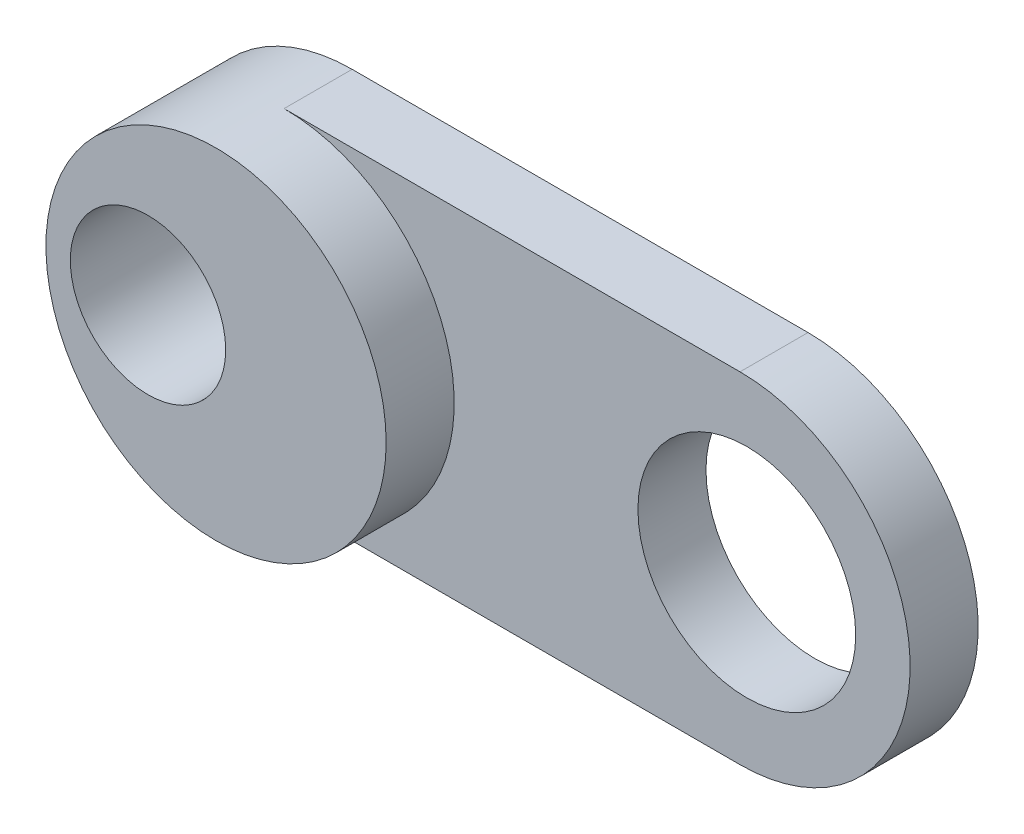
from build123d import *

# Parameters (mm, degrees)
SKETCH1_R           = 2.9
SKETCH1_R_2         = 4.064
BOSS_EXTRUDE1_DEPTH = 2.54
SKETCH2_R           = 2.9
BOSS_EXTRUDE2_DEPTH = 2.54


with BuildPart() as part:
    # Sketch1 → Boss-Extrude1 (new body)
    with BuildSketch(Plane.XY):
        with BuildLine():
            Line((0, 12.7), (17.018, 12.7))
            ThreePointArc((17.018, 12.7), (23.368, 6.35), (17.018, 0))
            Line((17.018, 0), (0, 0))
            ThreePointArc((0, 0), (-6.35, 6.35), (0, 12.7))
        make_face()
        with Locations((-2.54, 6.35)):
            Circle(SKETCH1_R, mode=Mode.SUBTRACT)
        with Locations((17.272, 6.35)):
            Circle(SKETCH1_R_2, mode=Mode.SUBTRACT)
    extrude(amount=BOSS_EXTRUDE1_DEPTH)

    # Sketch2 → Boss-Extrude2 (add)
    with BuildSketch(Plane.XY.offset(2.54)):
        with BuildLine():
            ThreePointArc((0, 0), (4.490128061, 1.859871939), (6.35, 6.35))
            ThreePointArc((6.35, 6.35), (4.490128061, 10.840128061), (0, 12.7))
            ThreePointArc((0, 12.7), (-6.35, 6.35), (0, 0))
        make_face()
        with Locations((-2.54, 6.35)):
            Circle(SKETCH2_R, mode=Mode.SUBTRACT)
    extrude(amount=BOSS_EXTRUDE2_DEPTH)


solid = part.part
